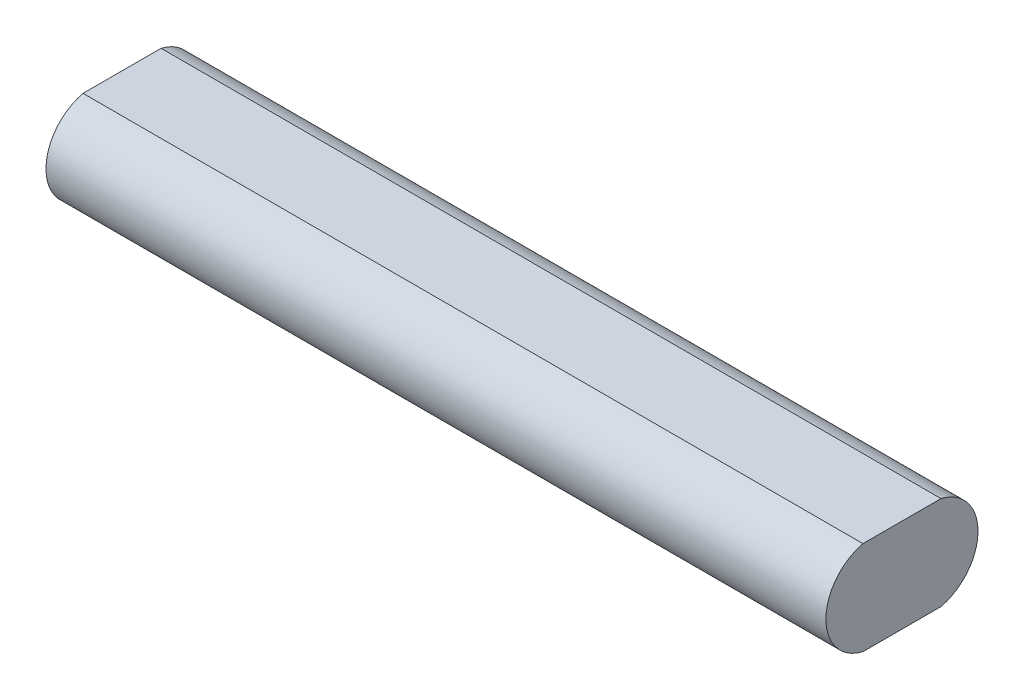
from build123d import *

# Parameters (mm, degrees)
SKETCH1_W           = 40
SKETCH1_H           = 8
BOSS_EXTRUDE1_DEPTH = 4.8
CUT_EXTRUDE1_DEPTH  = 41.485058972


with BuildPart() as part:
    # Sketch1 → Boss-Extrude1 (new body)
    with BuildSketch(Plane(origin=(0, 0, 0), x_dir=(1, 0, 0), z_dir=(0, 1, 0))):
        Rectangle(SKETCH1_W, SKETCH1_H)
    extrude(amount=BOSS_EXTRUDE1_DEPTH)

    # Sketch2 → Cut-Extrude1 (cut, through all)
    with BuildSketch(Plane(origin=(20, 0, 0), x_dir=(0, 0, -1), z_dir=(1, 0, 0))):
        with BuildLine():
            Line((-2.001359705, 4.8), (-4, 4.8))
            Line((-4, 4.8), (-4, 0))
            Line((-4, 0), (-2.001359705, 0))
            ThreePointArc((-2.001359705, 0), (-3.9, 2.4), (-2.001359705, 4.8))
        make_face()
        with BuildLine():
            Line((4, 4.8), (4, 0))
            Line((4, 0), (2.001359705, 0))
            ThreePointArc((2.001359705, 0), (3.9, 2.4), (2.001359705, 4.8))
            Line((2.001359705, 4.8), (4, 4.8))
        make_face()
    extrude(amount=-CUT_EXTRUDE1_DEPTH, mode=Mode.SUBTRACT)


solid = part.part
